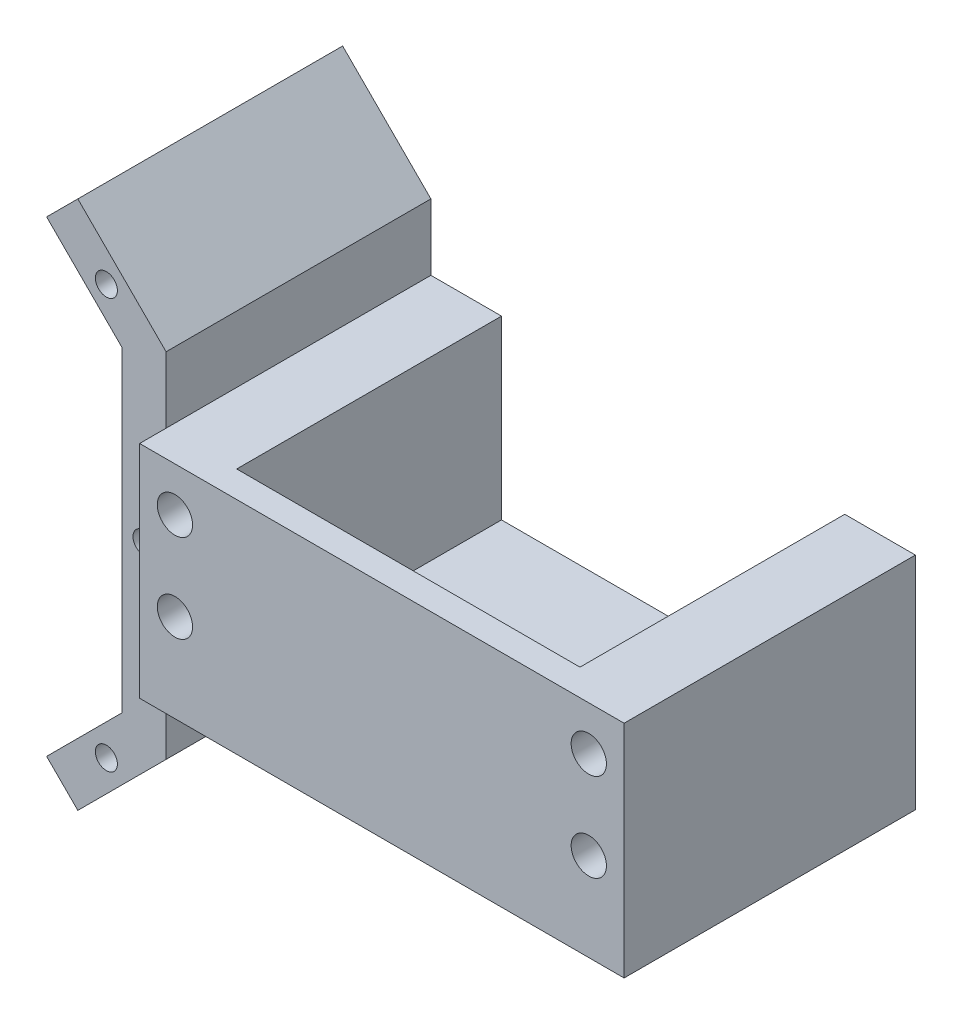
from build123d import *

# Parameters (mm, degrees)
MODEL_R             = 1.25
BOSS_EXTRUDE1_DEPTH = 30
SKETCH1_R           = 2
BOSS_EXTRUDE3_DEPTH = 33
SKETCH3_W           = 38.889950408
SKETCH3_H           = 20
BOSS_EXTRUDE6_DEPTH = 3


with BuildPart() as part:
    # Model → Boss-Extrude1 (new body)
    with BuildSketch(Plane.XY):
        Polygon((29.652943866, 16.209286981), (29.652943866, 56.209286981), (19.652943866, 66.209286981), (16.11740996, 62.673753075), (24.652943866, 54.138219169), (24.652943866, 18.280354793), (16.11740996, 9.744820887), (19.652943866, 6.209286981), align=None)
        with Locations((22.885176913, 12.977053934)):
            Circle(MODEL_R, mode=Mode.SUBTRACT)
        with Locations((27.152943866, 36.209286981)):
            Circle(MODEL_R, mode=Mode.SUBTRACT)
        with Locations((22.885176913, 59.441520028)):
            Circle(MODEL_R, mode=Mode.SUBTRACT)
    extrude(amount=BOSS_EXTRUDE1_DEPTH)

    # Sketch1 → Boss-Extrude3 (add)
    with BuildSketch(Plane(origin=(0, 0, 0), x_dir=(-1, 0, 0), z_dir=(0, 0, -1))):
        Polygon((-37.652943866, 28.709286981), (-76.542894274, 28.709286981), (-76.542894274, 48.709286981), (-84.542894274, 48.709286981), (-84.542894274, 23.709286981), (-76.542894274, 23.709286981), (-29.652943866, 23.709286981), (-29.652943866, 28.709286981), (-29.652943866, 48.709286981), (-37.652943866, 48.709286981), align=None)
        with Locations((-80.542894274, 33.709286981)):
            Circle(SKETCH1_R, mode=Mode.SUBTRACT)
        with Locations((-80.542894274, 43.709286981)):
            Circle(SKETCH1_R, mode=Mode.SUBTRACT)
        with Locations(Location((-33.652943866, 33.709286981, 0), (0, 0, 180))):
            Circle(SKETCH1_R, mode=Mode.SUBTRACT)
        with Locations(Location((-33.652943866, 43.709286981, 0), (0, 0, 180))):
            Circle(SKETCH1_R, mode=Mode.SUBTRACT)
    extrude(amount=-BOSS_EXTRUDE3_DEPTH)

    # Sketch3 → Boss-Extrude6 (add)
    with BuildSketch(Plane.XY.offset(33)):
        with Locations((57.09791907, 38.709286981)):
            Rectangle(SKETCH3_W, SKETCH3_H)
    extrude(amount=-BOSS_EXTRUDE6_DEPTH)


solid = part.part
